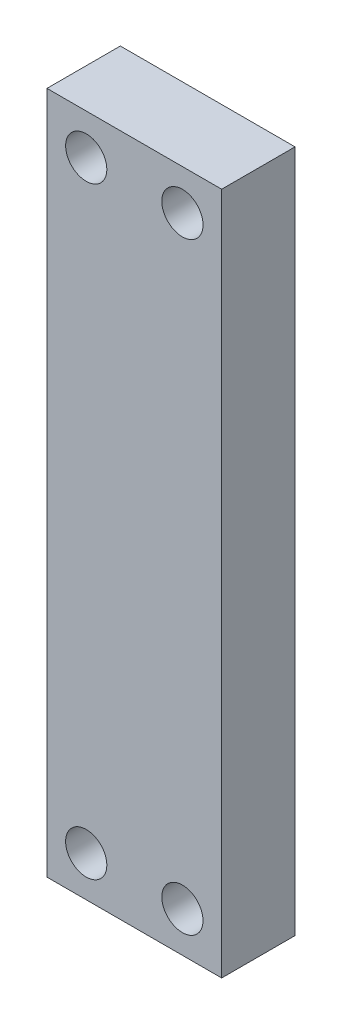
from build123d import *

# Parameters (mm, degrees)
SKETCH1_W             = 19.05
SKETCH1_H             = 74.4982
BOSS_EXTRUDE1_DEPTH   = 8.001
F_8_CLEARANCE_HOLE1_D = 4.4958


with BuildPart() as part:
    # Sketch1 → Boss-Extrude1 (new body)
    with BuildSketch(Plane.XY):
        Rectangle(SKETCH1_W, SKETCH1_H)
    extrude(amount=BOSS_EXTRUDE1_DEPTH)

    # #8 Clearance Hole1 (through all)
    with Locations(Plane.XY.offset(8.001)):
        with Locations((-5.2451, 32.8549), (5.2451, -32.8549), (-5.2451, -32.8549), (5.2451, 32.8549)):
            Hole(F_8_CLEARANCE_HOLE1_D / 2)


solid = part.part
